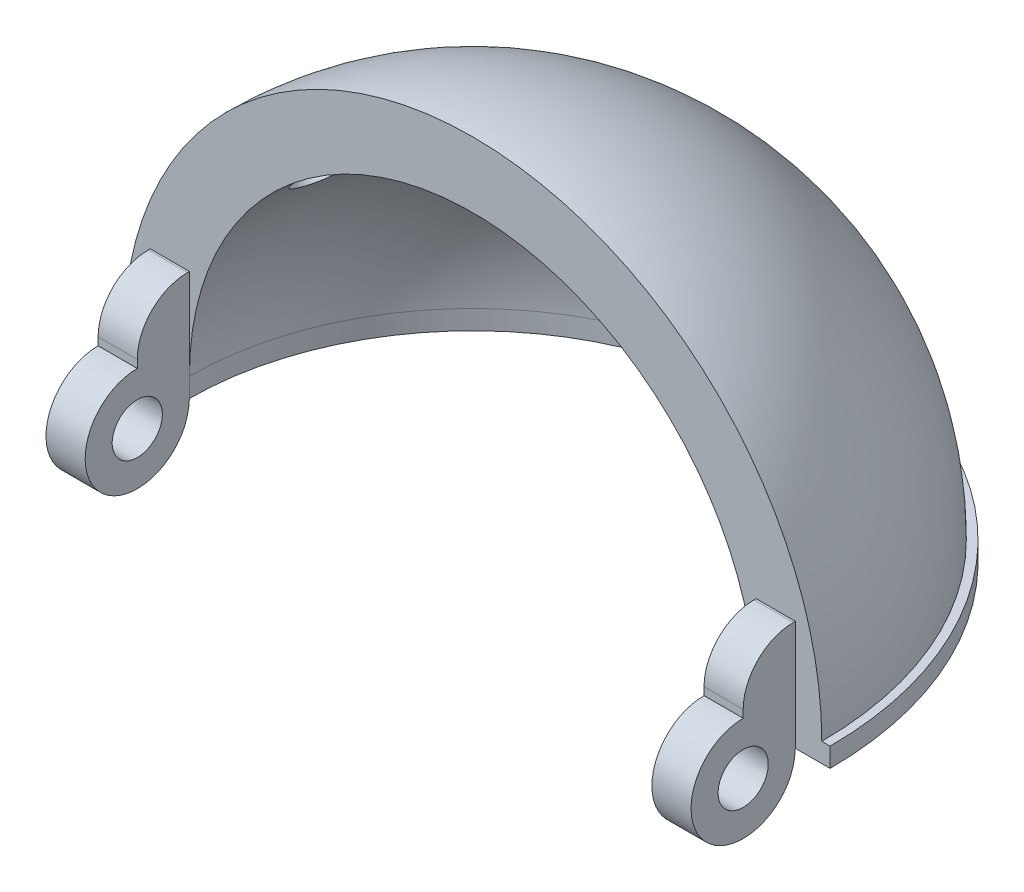
from build123d import *

# Parameters (mm, degrees)
BOSS_EXTRUDE1_DEPTH              = 1.27
REVOLVE3_ANGLE                   = 90
SKETCH6_W                        = 4.862612613
SKETCH6_H                        = 1.27
BOSS_EXTRUDE3_DEPTH              = 7.935530078
BOSS_EXTRUDE4_DEPTH              = 3.81
BOSS_EXTRUDE4_DEPTH_BACK         = 6.35
SKETCH10_W                       = 4.862612613
SKETCH10_H                       = 7.935530078
FILLET7_R                        = 5.08
FILLET10_R                       = 5.08
SKETCH13_R                       = 1.651
CUT_EXTRUDE2_DEPTH               = 55.372
SKETCH14_W                       = 2.286
SKETCH14_H                       = 11.368095807
CUT_EXTRUDE3_DEPTH               = 55.372
FILLET15_RADIUS                  = 3.967765039
FILLET15_LENGTH                  = 2.576612613
FILLET16_RADIUS                  = 3.967765039
FILLET16_LENGTH                  = 2.576612613
CUT_EXTRUDE4_DEPTH               = 55.372
CUT_EXTRUDE7_DEPTH               = 55.88
SKETCH19_W                       = 2.576612613
SKETCH19_H                       = 3.428576371
BOSS_EXTRUDE5_DEPTH              = 3.81
FILLET17_R                       = 3.302
FILLET18_R                       = 3.302
F_96_0_0063_DIAMETER_HOLE2_D     = 3.302
F_96_0_0063_DIAMETER_HOLE2_DEPTH = 25.4
F_96_0_0063_DIAMETER_HOLE2_TIP   = 0.992020882


with BuildPart() as part:
    # Sketch1 → Boss-Extrude1 (new body)
    with BuildSketch(Plane(origin=(0, 0, 0), x_dir=(1, 0, 0), z_dir=(0, 1, 0))):
        with BuildLine():
            Line((-18.44626818, 0), (-13.583655567, 0))
            ThreePointArc((-13.583655567, 0), (5.056359448, 18.640015015), (23.696374463, 0))
            Line((23.696374463, 0), (28.558987076, 0))
            ThreePointArc((28.558987076, 0), (5.056359448, 23.502627628), (-18.44626818, 0))
        make_face()
    extrude(amount=BOSS_EXTRUDE1_DEPTH)

    # Sketch4 → Revolve3 (revolve)
    with BuildSketch(Plane(origin=(0, 1.27, 0), x_dir=(1, 0, 0), z_dir=(0, 1, 0))):
        with BuildLine():
            Line((23.696374463, 0), (28.014374463, 0))
            ThreePointArc((28.014374463, 0), (5.056359448, 22.958015015), (-17.901655567, 0))
            Line((-17.901655567, 0), (-13.583655567, 0))
            ThreePointArc((-13.583655567, 0), (5.056359448, 18.640015015), (23.696374463, 0))
        make_face()
    revolve(axis=Axis((-17.901655567, 1.27, 0), (1, 0, 0)), revolution_arc=REVOLVE3_ANGLE)

    # Sketch6 → Boss-Extrude3 (add)
    with BuildSketch(Plane.XY):
        with Locations((-16.014961873, 0.635)):
            Rectangle(SKETCH6_W, SKETCH6_H)
        with Locations((26.12768077, 0.635)):
            Rectangle(SKETCH6_W, SKETCH6_H)
    extrude(amount=BOSS_EXTRUDE3_DEPTH)

    # Sketch10 → Boss-Extrude4 (add, two sides: drawn at the far end of the back side and taken through both)
    with BuildSketch(Plane(origin=(0, 1.27, 0), x_dir=(1, 0, 0), z_dir=(0, 1, 0)).offset(-BOSS_EXTRUDE4_DEPTH_BACK)):
        with Locations((-16.014961873, -3.967765039)):
            Rectangle(SKETCH10_W, SKETCH10_H)
        with Locations((26.12768077, -3.967765039)):
            Rectangle(SKETCH10_W, SKETCH10_H)
    extrude(amount=BOSS_EXTRUDE4_DEPTH + BOSS_EXTRUDE4_DEPTH_BACK)

    # Fillet7
    fillet7_edges = [part.edges().sort_by_distance(p)[0] for p in [
        (-16.014961873, 5.08, 7.935530078),
    ]]
    fillet(fillet7_edges, radius=FILLET7_R)

    # Fillet10
    fillet10_edges = [part.edges().sort_by_distance(p)[0] for p in [
        (26.127680769, 5.08, 7.935530078),
    ]]
    fillet(fillet10_edges, radius=FILLET10_R)

    # Sketch13 → Cut-Extrude2 (cut)
    with BuildSketch(Plane.ZY.offset(18.44626818)):
        with Locations((3.428576371, 0)):
            Circle(SKETCH13_R)
    extrude(amount=-CUT_EXTRUDE2_DEPTH, mode=Mode.SUBTRACT)

    # Sketch14 → Cut-Extrude3 (cut)
    with BuildSketch(Plane(origin=(0, 5.08, 0), x_dir=(1, 0, 0), z_dir=(0, 1, 0))):
        with Locations((27.415987076, -5.684047904)):
            Rectangle(SKETCH14_W, SKETCH14_H)
        with Locations((-17.30326818, -5.684047904)):
            Rectangle(SKETCH14_W, SKETCH14_H)
    extrude(amount=-CUT_EXTRUDE3_DEPTH, mode=Mode.SUBTRACT)

    # Fillet15: full round fillet: the end face becomes a half cylinder, R = half its width
    fillet15_face = Plane((24.984680769, -5.08, 3.967765039), x_dir=(1, 0, 0), z_dir=(0, -1, 0))  # on the end face: x along it, z out of the body
    fillet15_slab = fillet15_face.offset(-FILLET15_RADIUS / 2) * Box(FILLET15_LENGTH, 2 * FILLET15_RADIUS, FILLET15_RADIUS, mode=Mode.PRIVATE)  # the body's end, R deep
    fillet15_round = Plane((24.984680769, -1.112234961, 3.967765039), x_dir=(0, -1, 0), z_dir=(1, 0, 0)) * Cylinder(FILLET15_RADIUS, FILLET15_LENGTH, mode=Mode.PRIVATE)  # its axis R under the face
    add(fillet15_slab - fillet15_round, mode=Mode.SUBTRACT)

    # Fillet16: full round fillet: the end face becomes a half cylinder, R = half its width
    fillet16_face = Plane((-14.871961873, -5.08, 3.967765039), x_dir=(-1, 0, 0), z_dir=(0, -1, 0))  # on the end face: x along it, z out of the body
    fillet16_slab = fillet16_face.offset(-FILLET16_RADIUS / 2) * Box(FILLET16_LENGTH, 2 * FILLET16_RADIUS, FILLET16_RADIUS, mode=Mode.PRIVATE)  # the body's end, R deep
    fillet16_round = Plane((-14.871961873, -1.112234961, 3.967765039), x_dir=(0, -1, 0), z_dir=(-1, 0, 0)) * Cylinder(FILLET16_RADIUS, FILLET16_LENGTH, mode=Mode.PRIVATE)  # its axis R under the face
    add(fillet16_slab - fillet16_round, mode=Mode.SUBTRACT)

    # Sketch16 → Cut-Extrude4 (cut)
    with BuildSketch(Plane(origin=(26.272987076, 0, 0), x_dir=(0, 0, -1), z_dir=(1, 0, 0))):
        with BuildLine():
            ThreePointArc((0, 0), (-3.716578938, -3.862364093), (-7.935530078, -0.55611748))
            ThreePointArc((-7.935530078, -0.55611748), (-3.630565744, -5.089731167), (0, 0))
        make_face()
    extrude(amount=-CUT_EXTRUDE4_DEPTH, mode=Mode.SUBTRACT)

    # Sketch18 → Cut-Extrude7 (cut)
    with BuildSketch(Plane(origin=(26.272987076, 0, 0), x_dir=(0, 0, -1), z_dir=(1, 0, 0))):
        with BuildLine():
            Line((-3.428576371, 3.428576371), (0, 3.428576371))
            Line((0, 3.428576371), (0, 5.467356317))
            Line((0, 5.467356317), (-9.031573881, 5.467356317))
            Line((-9.031573881, 5.467356317), (-9.031573881, -4.486785293))
            Line((-9.031573881, -4.486785293), (0, -4.486785293))
            Line((0, -4.486785293), (0, 0))
            ThreePointArc((0, 0), (-5.852945973, -2.424369602), (-3.428576371, 3.428576371))
        make_face()
    extrude(amount=-CUT_EXTRUDE7_DEPTH, mode=Mode.SUBTRACT)

    # Sketch19 → Boss-Extrude5 (add)
    with BuildSketch(Plane(origin=(0, 3.428576371, 0), x_dir=(1, 0, 0), z_dir=(0, 1, 0))):
        with Locations((24.98468077, -1.714288186)):
            Rectangle(SKETCH19_W, SKETCH19_H)
        with Locations((-14.871961874, -1.714288186)):
            Rectangle(SKETCH19_W, SKETCH19_H)
    extrude(amount=BOSS_EXTRUDE5_DEPTH)

    # Fillet17
    fillet17_edges = [part.edges().sort_by_distance(p)[0] for p in [
        (24.984680769, 7.238576371, 3.428576371),
    ]]
    fillet(fillet17_edges, radius=FILLET17_R)

    # Fillet18
    fillet18_edges = [part.edges().sort_by_distance(p)[0] for p in [
        (-14.871961873, 7.238576371, 3.428576371),
    ]]
    fillet(fillet18_edges, radius=FILLET18_R)

    # #96 (0.0063) Diameter Hole2
    with Locations(Plane(origin=(-11.529605698, 16.548146571, -4.307487778), x_dir=(-0.677514134429, -0.735509753605, 0), z_dir=(-0.722447700093, 0.665482035826, -0.187624573613))):
        with Locations((0, 0)):
            Hole(F_96_0_0063_DIAMETER_HOLE2_D / 2, depth=F_96_0_0063_DIAMETER_HOLE2_DEPTH)
            with Locations((0, 0, -(F_96_0_0063_DIAMETER_HOLE2_DEPTH + F_96_0_0063_DIAMETER_HOLE2_TIP / 2))):  # 118° drill point
                Cone(0, F_96_0_0063_DIAMETER_HOLE2_D / 2, F_96_0_0063_DIAMETER_HOLE2_TIP, mode=Mode.SUBTRACT)


solid = part.part
